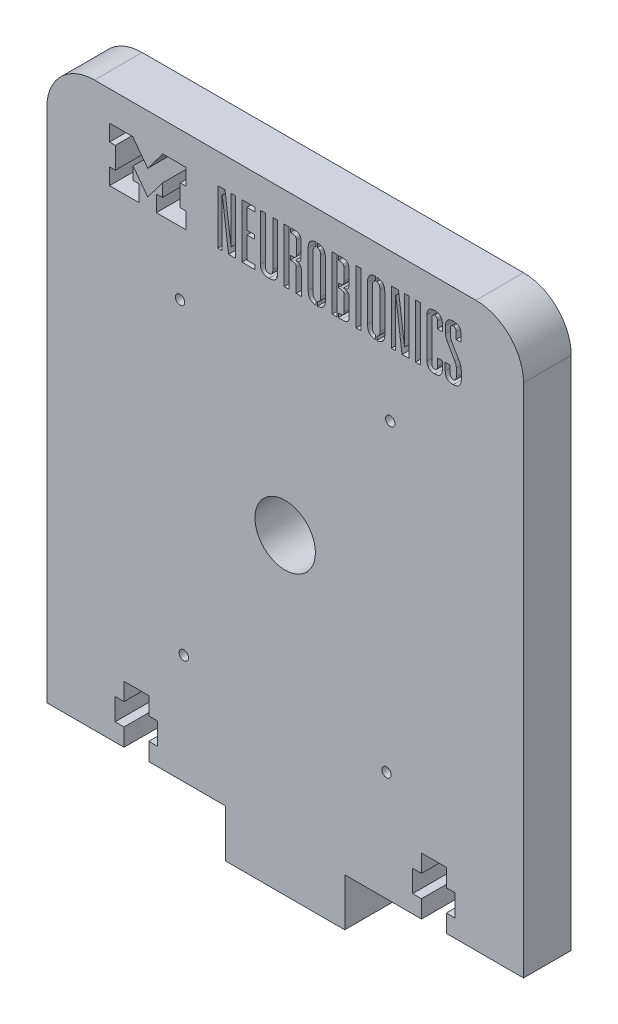
from build123d import *

# Parameters (mm, degrees)
SKETCH1_W             = 127
SKETCH1_H             = 150
BOSS_EXTRUDE1_DEPTH   = 12.7
SKETCH2_W             = 6.604
SKETCH2_H             = 4.699
SKETCH2_H_2           = 5.842
SKETCH2_W_2           = 2.3622
CUT_EXTRUDE1_DEPTH    = 197.952506966
FILLET1_R             = 12.7
SKETCH11_W            = 31.75
SKETCH11_H            = 12.7
BOSS_EXTRUDE2_DEPTH   = 12.7
CUT_EXTRUDE9_DEPTH    = 197.952506966
SKETCH19_W            = 1.320165
SKETCH19_H            = 14.40446524
CUT_EXTRUDE10_DEPTH   = 197.952506966
SKETCH21_R            = 8.05
CUT_EXTRUDE11_DEPTH   = 197.952507113
M3X0_5_TAPPED_HOLE1_D = 2.5
FILLET2_R             = 0.25


with BuildPart() as part:
    # Sketch1 → Boss-Extrude1 (new body)
    with BuildSketch(Plane.XY):
        with Locations((63.5, 75)):
            Rectangle(SKETCH1_W, SKETCH1_H)
    extrude(amount=BOSS_EXTRUDE1_DEPTH)

    # Sketch2 → Cut-Extrude1 (cut, through all)
    with BuildSketch(Plane.XY.offset(12.7)):
        with Locations((23.876, 12.8905)):
            Rectangle(SKETCH2_W, SKETCH2_H)
        with Locations((23.876, 7.62)):
            Rectangle(SKETCH2_W, SKETCH2_H_2)
        with Locations((28.3591, 7.62)):
            Rectangle(SKETCH2_W_2, SKETCH2_H_2)
        with Locations((19.3929, 7.62)):
            Rectangle(SKETCH2_W_2, SKETCH2_H_2)
        with Locations((23.876, 2.3495)):
            Rectangle(SKETCH2_W, SKETCH2_H)
        with Locations((103.124, 2.3495)):
            Rectangle(SKETCH2_W, SKETCH2_H)
        with Locations((103.124, 7.62)):
            Rectangle(SKETCH2_W, SKETCH2_H_2)
        with Locations((107.6071, 7.62)):
            Rectangle(SKETCH2_W_2, SKETCH2_H_2)
        with Locations((103.124, 12.8905)):
            Rectangle(SKETCH2_W, SKETCH2_H)
        with Locations((98.6409, 7.62)):
            Rectangle(SKETCH2_W_2, SKETCH2_H_2)
    extrude(amount=-CUT_EXTRUDE1_DEPTH, mode=Mode.SUBTRACT)

    # Fillet1
    fillet1_edges = [part.edges().sort_by_distance(p)[0] for p in [
        (0, 150, 6.35),
        (127, 150, 6.35),
    ]]
    fillet(fillet1_edges, radius=FILLET1_R)

    # Sketch11 → Boss-Extrude2 (add)
    with BuildSketch(Plane.XZ):
        with Locations((63.5, 6.35)):
            Rectangle(SKETCH11_W, SKETCH11_H)
    extrude(amount=BOSS_EXTRUDE2_DEPTH)

    # Sketch20 → Cut-Extrude9 (cut, through all)
    with BuildSketch(Plane.XY.offset(12.7)):
        Polygon((22.97667018, 131.97336552), (24.604291259, 131.97336552), (24.604291259, 127.640619868), (16.714850296, 127.640619868), (16.714850296, 131.97336552), (18.254329992, 131.97336552), (18.254329992, 137.700621193), (16.714056676, 137.700621193), (16.714056676, 142.045085108), (22.890341603, 142.045085108), (26.901674355, 136.730226684), (30.913007108, 142.045085108), (37.089292035, 142.045085108), (37.089292035, 137.700621193), (35.549018719, 137.700621193), (35.549018719, 131.97336552), (37.088498415, 131.97336552), (37.088498415, 127.640619868), (29.199057452, 127.640619868), (29.199057452, 131.97336552), (30.826678531, 131.97336552), (30.826678531, 135.321098969), (26.901674355, 130.12062252), (22.97667018, 135.321098969), align=None)
    extrude(amount=-CUT_EXTRUDE9_DEPTH, mode=Mode.SUBTRACT)

    # Sketch19 → Cut-Extrude10 (cut, through all)
    with BuildSketch(Plane.XY.offset(12.7)):
        with BuildLine():
            Line((64.919332717, 135.678954152), (64.919332717, 134.564150108))
            Line((64.919332717, 134.564150108), (65.415267123, 134.564150108))
            add(Edge.make_bspline(
                [(66.456730818, 133.684040108), (66.456730818, 134.388128108), (66.031344123, 134.564150108), (65.415267123, 134.564150108)],
                knots=[0, 0, 0, 0, 1, 1, 1, 1], degree=3))
            Line((66.456730818, 133.684040108), (66.442061927, 133.684023484))
            Line((66.442061927, 133.684023484), (66.442061927, 127.640603244))
            Line((66.442061927, 127.640603244), (67.796402522, 127.640603244))
            Line((67.796402522, 127.640603244), (67.796402522, 133.801373244))
            add(Edge.make_bspline(
                [(66.300215522, 135.136207722), (67.238999913, 135.077535482), (67.796402522, 134.7988332), (67.796402522, 133.801373244)],
                knots=[0, 0, 0, 0, 1, 1, 1, 1], degree=3))
            Line((66.300215522, 135.136207722), (66.300215522, 135.180227108))
            add(Edge.make_bspline(
                [(67.737728717, 136.735086152), (67.737728717, 135.620282108), (67.312342022, 135.238899152), (66.300215522, 135.180227108)],
                knots=[0, 0, 0, 0, 1, 1, 1, 1], degree=3))
            Line((67.737728717, 136.735086152), (67.737728717, 140.387545586))
            add(Edge.make_bspline(
                [(65.698807413, 142.045085108), (66.960298022, 142.045085108), (67.737728717, 141.825060346), (67.737728717, 140.387545586)],
                knots=[0, 0, 0, 0, 1, 1, 1, 1], degree=3))
            Line((65.698807413, 142.045085108), (64.919332717, 142.045085108))
            Line((64.919332717, 142.045085108), (64.919332717, 140.930280868))
            Line((64.919332717, 140.930280868), (65.378467238, 140.930280868))
            add(Edge.make_bspline(
                [(66.493273629, 139.947490586), (66.493273629, 140.783592152), (66.053218629, 140.930280868), (65.378467238, 140.930280868)],
                knots=[0, 0, 0, 0, 1, 1, 1, 1], degree=3))
            Line((66.493273629, 139.947490586), (66.493273629, 136.720422346))
            add(Edge.make_bspline(
                [(65.510483738, 135.678954152), (66.126560738, 135.678954152), (66.493273629, 135.854976152), (66.493273629, 136.720422346)],
                knots=[0, 0, 0, 0, 1, 1, 1, 1], degree=3))
            Line((65.510483738, 135.678954152), (64.919332717, 135.678954152))
        make_face()
        Polygon((64.569332717, 140.93031325), (64.569332717, 142.045085108), (63.249167717, 142.045085108), (63.249167717, 127.640619868), (64.569332717, 127.640619868), align=None)
        Polygon((46.761773522, 140.44621763), (46.717770955, 140.44621763), (46.717770955, 127.640619868), (45.558959455, 127.640619868), (45.558959455, 142.045085108), (47.480533151, 142.045085108), (49.094067955, 129.723545108), (49.138070522, 129.723545108), (49.138070522, 142.045085108), (50.296882413, 142.045085108), (50.296882413, 127.640619868), (48.419314217, 127.640619868), align=None)
        with BuildLine():
            Line((58.217872413, 142.045085108), (58.217872413, 130.002247586))
            add(Edge.make_bspline(
                [(58.217872413, 130.002247586), (58.217872413, 128.960784868), (58.555247522, 128.65274363), (59.215330022, 128.65274363)],
                knots=[0, 0, 0, 0, 1, 1, 1, 1], degree=3))
            add(Edge.make_bspline(
                [(59.215330022, 128.65274363), (59.890081413, 128.65274363), (60.212788217, 128.975454346), (60.212788217, 130.002247586)],
                knots=[0, 0, 0, 0, 1, 1, 1, 1], degree=3))
            Line((60.212788217, 130.002247586), (60.212788217, 142.045085108))
            Line((60.212788217, 142.045085108), (61.518284913, 142.045085108))
            Line((61.518284913, 142.045085108), (61.518284913, 129.576861868))
            add(Edge.make_bspline(
                [(61.518284913, 129.576861868), (61.518284913, 127.977994586), (60.315467522, 127.523270108), (59.185993413, 127.523270108)],
                knots=[0, 0, 0, 0, 1, 1, 1, 1], degree=3))
            add(Edge.make_bspline(
                [(59.185993413, 127.523270108), (58.085855913, 127.523270108), (56.897707413, 127.977994586), (56.897707413, 129.576861868)],
                knots=[0, 0, 0, 0, 1, 1, 1, 1], degree=3))
            Line((56.897707413, 129.576861868), (56.897707413, 142.045085108))
            Line((56.897707413, 142.045085108), (58.217872413, 142.045085108))
        make_face()
        with BuildLine():
            Line((74.230211032, 139.727460153), (74.230211032, 129.958239152))
            add(Edge.make_bspline(
                [(74.230211032, 129.958239152), (74.230211032, 128.588188835), (73.727002155, 127.598938483), (72.105088423, 127.527419045)],
                knots=[0, 0, 0, 0, 0.962898501, 0.962898501, 0.962898501, 0.962898501], degree=3))
            Line((72.105088423, 127.527419045), (72.105088423, 128.649158115))
            add(Edge.make_bspline(
                [(72.105088423, 128.649158115), (72.774089716, 128.731143819), (72.910046032, 129.260484228), (72.910046032, 129.987578109)],
                knots=[0.082066912, 0.082066912, 0.082066912, 0.082066912, 1, 1, 1, 1], degree=3))
            Line((72.910046032, 129.987578109), (72.910046032, 139.683457587))
            add(Edge.make_bspline(
                [(72.910046032, 139.683457587), (72.910046032, 140.410551468), (72.774089716, 140.939891712), (72.105088423, 141.021877389)],
                knots=[0, 0, 0, 0, 0.917933088, 0.917933088, 0.917933088, 0.917933088], degree=3))
            Line((72.105088423, 141.021877389), (72.105088423, 142.158285932))
            add(Edge.make_bspline(
                [(72.105088423, 142.158285932), (73.727002155, 142.086766486), (74.230211032, 141.097515931), (74.230211032, 139.727460153)],
                knots=[0.037101499, 0.037101499, 0.037101499, 0.037101499, 1, 1, 1, 1], degree=3))
        make_face()
        Polygon((77.316259413, 134.564150108), (77.316259413, 128.755424108), (77.316259413, 127.640603244), (76.010762717, 127.640603244), (76.010762717, 142.045085108), (77.316259413, 142.045085108), (77.316259413, 140.930280868), (77.316259413, 135.678954152), align=None)
        Polygon((94.625086479, 127.640619868), (92.967546957, 140.44621763), (92.923527571, 140.44621763), (92.923527571, 127.640619868), (91.764715093, 127.640619868), (91.764715093, 142.045085108), (93.686287811, 142.045085108), (95.299824571, 129.723545108), (95.343843957, 129.723545108), (95.343843957, 142.045085108), (96.502656435, 142.045085108), (96.502656435, 127.640619868), align=None)
        with BuildLine():
            Line((104.056932957, 129.547523108), (104.056932957, 131.55710663))
            Line((104.056932957, 131.55710663), (105.377097957, 131.55710663))
            Line((105.377097957, 131.55710663), (105.377097957, 129.503520346))
            add(Edge.make_bspline(
                [(105.377097957, 129.503520346), (105.377097957, 128.286030152), (104.702348717, 127.50860063), (103.323511673, 127.50860063)],
                knots=[0, 0, 0, 0, 1, 1, 1, 1], degree=3))
            add(Edge.make_bspline(
                [(103.323511673, 127.50860063), (101.944668957, 127.50860063), (101.269919717, 128.286030152), (101.269919717, 129.503520346)],
                knots=[0, 0, 0, 0, 1, 1, 1, 1], degree=3))
            Line((101.269919717, 129.503520346), (101.269919717, 140.152851346))
            add(Edge.make_bspline(
                [(101.269919717, 140.152851346), (101.269919717, 141.370335868), (101.944668957, 142.147765586), (103.323511673, 142.147765586)],
                knots=[0, 0, 0, 0, 1, 1, 1, 1], degree=3))
            add(Edge.make_bspline(
                [(103.323511673, 142.147765586), (104.702348717, 142.147765586), (105.377097957, 141.370335868), (105.377097957, 140.152851346)],
                knots=[0, 0, 0, 0, 1, 1, 1, 1], degree=3))
            Line((105.377097957, 140.152851346), (105.377097957, 138.275281586))
            Line((105.377097957, 138.275281586), (104.056932957, 138.275281586))
            Line((104.056932957, 138.275281586), (104.056932957, 140.123512586))
            add(Edge.make_bspline(
                [(104.056932957, 140.123512586), (104.056932957, 140.739589586), (103.836908195, 141.047625152), (103.323511673, 141.047625152)],
                knots=[0, 0, 0, 0, 1, 1, 1, 1], degree=3))
            add(Edge.make_bspline(
                [(103.323511673, 141.047625152), (102.810109479, 141.047625152), (102.590084717, 140.754258868), (102.590084717, 140.123512586)],
                knots=[0, 0, 0, 0, 1, 1, 1, 1], degree=3))
            Line((102.590084717, 140.123512586), (102.590084717, 129.547523108))
            add(Edge.make_bspline(
                [(102.590084717, 129.547523108), (102.590084717, 128.931446108), (102.810109479, 128.623410346), (103.323511673, 128.623410346)],
                knots=[0, 0, 0, 0, 1, 1, 1, 1], degree=3))
            add(Edge.make_bspline(
                [(103.323511673, 128.623410346), (103.836908195, 128.623410346), (104.056932957, 128.91677663), (104.056932957, 129.547523108)],
                knots=[0, 0, 0, 0, 1, 1, 1, 1], degree=3))
        make_face()
        with BuildLine():
            Line((107.533370195, 140.064840346), (107.533370195, 138.553983868))
            add(Edge.make_bspline(
                [(107.533370195, 138.553983868), (107.533370195, 138.099259586), (107.606711717, 137.62986563), (107.826736479, 137.263152152)],
                knots=[0, 0, 0, 0, 1, 1, 1, 1], degree=3))
            Line((107.826736479, 137.263152152), (109.924336673, 133.66937063))
            add(Edge.make_bspline(
                [(109.924336673, 133.66937063), (110.217702957, 133.170643586), (110.408394435, 132.554566586), (110.408394435, 131.90915063)],
                knots=[0, 0, 0, 0, 1, 1, 1, 1], degree=3))
            Line((110.408394435, 131.90915063), (110.408394435, 129.635534108))
            add(Edge.make_bspline(
                [(110.408394435, 129.635534108), (110.408394435, 128.286030152), (109.616295435, 127.523270108), (108.296130435, 127.523270108)],
                knots=[0, 0, 0, 0, 1, 1, 1, 1], degree=3))
            add(Edge.make_bspline(
                [(108.296130435, 127.523270108), (106.843951673, 127.523270108), (106.139863673, 128.183355346), (106.139863673, 129.635534108)],
                knots=[0, 0, 0, 0, 1, 1, 1, 1], degree=3))
            Line((106.139863673, 129.635534108), (106.139863673, 131.615784346))
            Line((106.139863673, 131.615784346), (107.460028673, 131.615784346))
            Line((107.460028673, 131.615784346), (107.460028673, 129.723545108))
            add(Edge.make_bspline(
                [(107.460028673, 129.723545108), (107.460028673, 129.048795868), (107.724061673, 128.65274363), (108.296130435, 128.65274363)],
                knots=[0, 0, 0, 0, 1, 1, 1, 1], degree=3))
            add(Edge.make_bspline(
                [(108.296130435, 128.65274363), (108.838865717, 128.65274363), (109.088229435, 129.048795868), (109.088229435, 129.723545108)],
                knots=[0, 0, 0, 0, 1, 1, 1, 1], degree=3))
            Line((109.088229435, 129.723545108), (109.088229435, 131.73312863))
            add(Edge.make_bspline(
                [(109.088229435, 131.73312863), (109.088229435, 132.231861346), (108.985548957, 132.61323863), (108.706846479, 133.111971346)],
                knots=[0, 0, 0, 0, 1, 1, 1, 1], degree=3))
            Line((108.706846479, 133.111971346), (106.770604479, 136.48572263))
            add(Edge.make_bspline(
                [(106.770604479, 136.48572263), (106.418560479, 137.10179963), (106.213205195, 137.585862868), (106.213205195, 138.319284152)],
                knots=[0, 0, 0, 0, 1, 1, 1, 1], degree=3))
            Line((106.213205195, 138.319284152), (106.213205195, 140.050170868))
            add(Edge.make_bspline(
                [(106.213205195, 140.050170868), (106.213205195, 141.473016346), (106.946626479, 142.162434868), (108.281460957, 142.162434868)],
                knots=[0, 0, 0, 0, 1, 1, 1, 1], degree=3))
            add(Edge.make_bspline(
                [(108.281460957, 142.162434868), (109.762978479, 142.162434868), (110.349722195, 141.458346868), (110.349722195, 140.152851346)],
                knots=[0, 0, 0, 0, 1, 1, 1, 1], degree=3))
            Line((110.349722195, 140.152851346), (110.349722195, 138.319284152))
            Line((110.349722195, 138.319284152), (109.029557195, 138.319284152))
            Line((109.029557195, 138.319284152), (109.029557195, 140.064840346))
            Line((109.029557195, 140.064840346), (109.058890479, 140.064840346))
            add(Edge.make_bspline(
                [(109.058890479, 140.064840346), (109.058890479, 140.62223963), (108.912207435, 141.047625152), (108.296130435, 141.047625152)],
                knots=[0, 0, 0, 0, 1, 1, 1, 1], degree=3))
            add(Edge.make_bspline(
                [(108.296130435, 141.047625152), (107.680053435, 141.047625152), (107.533370195, 140.62223963), (107.533370195, 140.064840346)],
                knots=[0, 0, 0, 0, 1, 1, 1, 1], degree=3))
        make_face()
        with BuildLine():
            Line((85.442609195, 129.958239152), (85.442609195, 139.727460153))
            add(Edge.make_bspline(
                [(85.442609195, 139.727460153), (85.442609195, 141.097515797), (85.945819062, 142.086766292), (87.567728479, 142.158285911)],
                knots=[0, 0, 0, 0, 0.962898407, 0.962898407, 0.962898407, 0.962898407], degree=3))
            Line((87.567728479, 142.158285911), (87.567728479, 141.021877309))
            add(Edge.make_bspline(
                [(87.567728479, 141.021877309), (86.898729931, 140.939891377), (86.762774195, 140.410551237), (86.762774195, 139.683457585)],
                knots=[0.0820672, 0.0820672, 0.0820672, 0.0820672, 1, 1, 1, 1], degree=3))
            Line((86.762774195, 139.683457585), (86.762774195, 129.987578107))
            add(Edge.make_bspline(
                [(86.762774195, 129.987578107), (86.762774195, 129.260484455), (86.898729931, 128.731144151), (87.567728479, 128.649158191)],
                knots=[0, 0, 0, 0, 0.917932799, 0.917932799, 0.917932799, 0.917932799], degree=3))
            Line((87.567728479, 128.649158191), (87.567728479, 127.527419066))
            add(Edge.make_bspline(
                [(87.567728479, 127.527419066), (85.945819062, 127.598938677), (85.442609195, 128.58818897), (85.442609195, 129.958239152)],
                knots=[0.037101593, 0.037101593, 0.037101593, 0.037101593, 1, 1, 1, 1], degree=3))
        make_face()
        with Locations((98.849617217, 134.842852488)):
            Rectangle(SKETCH19_W, SKETCH19_H)
        Polygon((53.318593022, 135.678954152), (55.386851522, 135.678954152), (55.386851522, 134.564150108), (53.318593022, 134.564150108), (53.318593022, 128.755424108), (55.489531413, 128.755424108), (55.489531413, 127.640619868), (51.998428022, 127.640619868), (51.998428022, 142.045085108), (55.489531413, 142.045085108), (55.489531413, 140.930280868), (53.318593022, 140.930280868), align=None)
        with BuildLine():
            Line((80.499323717, 140.387545586), (80.499323717, 136.735086152))
            add(Edge.make_bspline(
                [(80.499323717, 136.735086152), (80.499323717, 135.620282108), (80.073938195, 135.224235346), (79.061810522, 135.180227108)],
                knots=[0, 0, 0, 0, 1, 1, 1, 1], degree=3))
            Line((79.061810522, 135.180227108), (79.061810522, 135.136207722))
            add(Edge.make_bspline(
                [(79.061810522, 135.136207722), (79.985927195, 135.092188336), (80.557995957, 134.7988332), (80.557995957, 133.801373244)],
                knots=[0, 0, 0, 0, 1, 1, 1, 1], degree=3))
            Line((80.557995957, 133.801373244), (80.557995957, 129.298142962))
            add(Edge.make_bspline(
                [(80.557995957, 129.298142962), (80.557995957, 127.860633482), (79.780566435, 127.640603244), (78.460402413, 127.640603244)],
                knots=[0, 0, 0, 0, 1, 1, 1, 1], degree=3))
            Line((78.460402413, 127.640603244), (77.666259413, 127.640603244))
            Line((77.666259413, 127.640603244), (77.666259413, 128.755424108))
            Line((77.666259413, 128.755424108), (78.088026717, 128.755424108))
            add(Edge.make_bspline(
                [(78.088026717, 128.755424108), (78.762777522, 128.755424108), (79.202832522, 128.902107152), (79.202832522, 129.738214586)],
                knots=[0, 0, 0, 0, 1, 1, 1, 1], degree=3))
            Line((79.202832522, 129.738214586), (79.202832522, 133.684040108))
            add(Edge.make_bspline(
                [(79.202832522, 133.684040108), (79.202832522, 134.388128108), (78.777446413, 134.564150108), (78.161369413, 134.564150108)],
                knots=[0, 0, 0, 0, 1, 1, 1, 1], degree=3))
            Line((78.161369413, 134.564150108), (77.666259413, 134.564150108))
            Line((77.666259413, 134.564150108), (77.666259413, 135.678954152))
            Line((77.666259413, 135.678954152), (78.146701108, 135.678954152))
            add(Edge.make_bspline(
                [(78.146701108, 135.678954152), (78.762778108, 135.678954152), (79.129490413, 135.854976152), (79.129490413, 136.720422346)],
                knots=[0, 0, 0, 0, 1, 1, 1, 1], degree=3))
            Line((79.129490413, 136.720422346), (79.129490413, 139.947490586))
            add(Edge.make_bspline(
                [(79.129490413, 139.947490586), (79.129490413, 140.783592152), (78.689435413, 140.930280868), (78.014684608, 140.930280868)],
                knots=[0, 0, 0, 0, 1, 1, 1, 1], degree=3))
            Line((78.014684608, 140.930280868), (77.666259413, 140.930280868))
            Line((77.666259413, 140.930280868), (77.666259413, 142.045085108))
            Line((77.666259413, 142.045085108), (78.460402413, 142.045085108))
            add(Edge.make_bspline(
                [(78.460402413, 142.045085108), (79.721893022, 142.045085108), (80.499323717, 141.825060346), (80.499323717, 140.387545586)],
                knots=[0, 0, 0, 0, 1, 1, 1, 1], degree=3))
        make_face()
        with BuildLine():
            Line((88.722688435, 129.987578107), (88.722688435, 139.683457585))
            add(Edge.make_bspline(
                [(88.722688435, 139.683457585), (88.722688435, 140.410551689), (88.586732366, 140.939892034), (87.917728479, 141.021877462)],
                knots=[0, 0, 0, 0, 0.917933369, 0.917933369, 0.917933369, 0.917933369], degree=3))
            Line((87.917728479, 141.021877462), (87.917728479, 142.158285937))
            add(Edge.make_bspline(
                [(87.917728479, 142.158285937), (89.539643443, 142.086766539), (90.042853435, 141.097515968), (90.042853435, 139.727460153)],
                knots=[0.037101473, 0.037101473, 0.037101473, 0.037101473, 1, 1, 1, 1], degree=3))
            Line((90.042853435, 139.727460153), (90.042853435, 129.958239152))
            add(Edge.make_bspline(
                [(90.042853435, 129.958239152), (90.042853435, 128.588188799), (89.539643443, 127.59893843), (87.917728479, 127.527419039)],
                knots=[0, 0, 0, 0, 0.962898527, 0.962898527, 0.962898527, 0.962898527], degree=3))
            Line((87.917728479, 127.527419039), (87.917728479, 128.649158038))
            add(Edge.make_bspline(
                [(87.917728479, 128.649158038), (88.586732365, 128.731143494), (88.722688435, 129.260484004), (88.722688435, 129.987578107)],
                knots=[0.082066631, 0.082066631, 0.082066631, 0.082066631, 1, 1, 1, 1], degree=3))
        make_face()
        with Locations((83.036976173, 134.842852488)):
            Rectangle(SKETCH19_W, SKETCH19_H)
        with BuildLine():
            Line((70.950130228, 139.683457587), (70.950130228, 129.98757811))
            add(Edge.make_bspline(
                [(70.950130228, 129.98757811), (70.950130228, 129.260484224), (71.086087039, 128.731143814), (71.755088423, 128.649158115)],
                knots=[0, 0, 0, 0, 0.917933093, 0.917933093, 0.917933093, 0.917933093], degree=3))
            Line((71.755088423, 128.649158115), (71.755088423, 127.527419042))
            add(Edge.make_bspline(
                [(71.755088423, 127.527419042), (70.133174118, 127.598938457), (69.629965228, 128.588188818), (69.629965228, 129.958239152)],
                knots=[0.037101486, 0.037101486, 0.037101486, 0.037101486, 1, 1, 1, 1], degree=3))
            Line((69.629965228, 129.958239152), (69.629965217, 139.727460152))
            add(Edge.make_bspline(
                [(69.629965217, 139.727460152), (69.629965217, 141.097515951), (70.13317411, 142.086766515), (71.755088423, 142.158285934)],
                knots=[0, 0, 0, 0, 0.962898516, 0.962898516, 0.962898516, 0.962898516], degree=3))
            Line((71.755088423, 142.158285934), (71.755088423, 141.02187739))
            add(Edge.make_bspline(
                [(71.755088423, 141.02187739), (71.086087039, 140.939891718), (70.950130228, 140.410551472), (70.950130228, 139.683457587)],
                knots=[0.082066907, 0.082066907, 0.082066907, 0.082066907, 1, 1, 1, 1], degree=3))
        make_face()
    extrude(amount=-CUT_EXTRUDE10_DEPTH, mode=Mode.SUBTRACT)

    # Sketch21 → Cut-Extrude11 (cut, through all)
    with BuildSketch(Plane.XY.offset(12.7)):
        with Locations((63.5, 70.3825868)):
            Circle(SKETCH21_R)
    extrude(amount=-CUT_EXTRUDE11_DEPTH, mode=Mode.SUBTRACT)

    # M3x0.5 Tapped Hole1 (through all)
    with Locations(Plane.XY.offset(12.7)):
        with Locations((35.50000012, 110.720694002), (36.5, 29.21)):
            m3x0_5_tapped_hole1 = Hole(M3X0_5_TAPPED_HOLE1_D / 2)

    # Mirror3: M3x0.5 Tapped Hole1 across plane
    add(m3x0_5_tapped_hole1.mirror(Plane(origin=(63.5, 0, 0), x_dir=(0, 0, 1), z_dir=(1, 0, 0))), mode=Mode.SUBTRACT)

    # Fillet2
    fillet2_edges = [part.edges().sort_by_distance(p)[0] for p in [
        (24.604291259, 131.97336552, 6.35),
        (29.199057452, 131.97336552, 6.35),
    ]]
    fillet(fillet2_edges, radius=FILLET2_R)


solid = part.part
